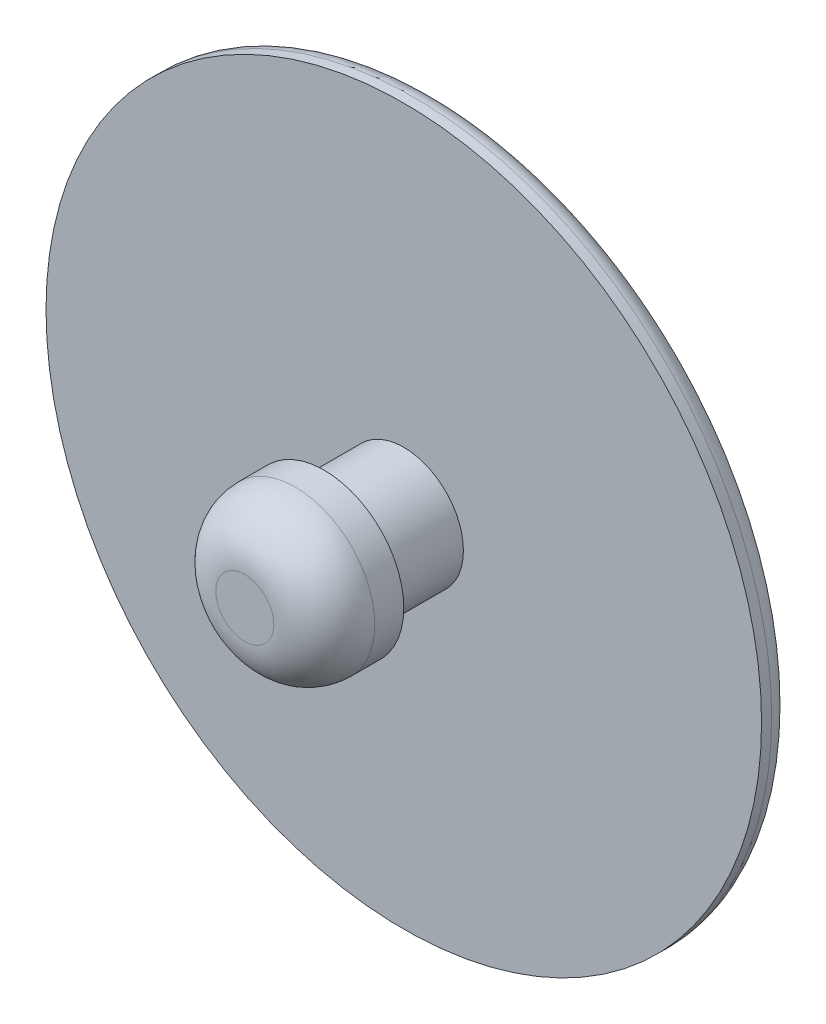
from build123d import *

# Parameters (mm, degrees)
SKETCH1_R           = 9
BOSS_EXTRUDE1_DEPTH = 0.762
FILLET1_R           = 0.508
SKETCH2_R           = 1.5
BOSS_EXTRUDE2_DEPTH = 2
SKETCH3_R           = 2
BOSS_EXTRUDE3_DEPTH = 2
FILLET2_R           = 1.27


with BuildPart() as part:
    # Sketch1 → Boss-Extrude1 (new body)
    with BuildSketch(Plane.XY):
        with Locations(Location((0, 0, 0), (0, 0, 180))):
            Circle(SKETCH1_R)
    extrude(amount=BOSS_EXTRUDE1_DEPTH)

    # Fillet1
    fillet1_edges = [part.edges().sort_by_distance(p)[0] for p in [
        (9, 0, 0),
    ]]
    fillet(fillet1_edges, radius=FILLET1_R)

    # Sketch2 → Boss-Extrude2 (add)
    with BuildSketch(Plane.XY.offset(0.762)):
        Circle(SKETCH2_R)
    extrude(amount=BOSS_EXTRUDE2_DEPTH)

    # Sketch3 → Boss-Extrude3 (add)
    with BuildSketch(Plane.XY.offset(2.762)):
        Circle(SKETCH3_R)
    extrude(amount=BOSS_EXTRUDE3_DEPTH)

    # Fillet2
    fillet2_edges = [part.edges().sort_by_distance(p)[0] for p in [
        (-2, 0, 4.762),
    ]]
    fillet(fillet2_edges, radius=FILLET2_R)


solid = part.part
